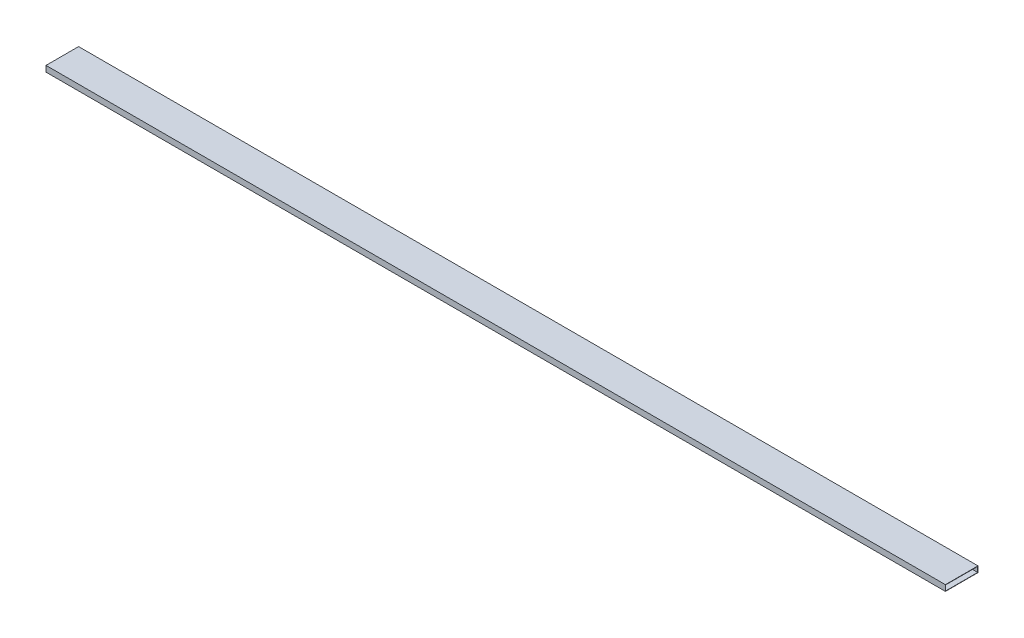
from build123d import *

# Parameters (mm, degrees)
SKETCH2_W           = 63.5
SKETCH2_H           = 11.43
SKETCH2_W_2         = 62.2808
SKETCH2_H_2         = 10.2108
BOSS_EXTRUDE1_DEPTH = 1752.6


with BuildPart() as part:
    # Sketch2 → Boss-Extrude1 (new body)
    with BuildSketch(Plane(origin=(0, 0, 0), x_dir=(0, 0, -1), z_dir=(1, 0, 0))):
        with Locations((-31.1404, 0)):
            Rectangle(SKETCH2_W, SKETCH2_H)
        with Locations((-31.1404, 0)):
            Rectangle(SKETCH2_W_2, SKETCH2_H_2, mode=Mode.SUBTRACT)
    extrude(amount=-BOSS_EXTRUDE1_DEPTH)


solid = part.part
